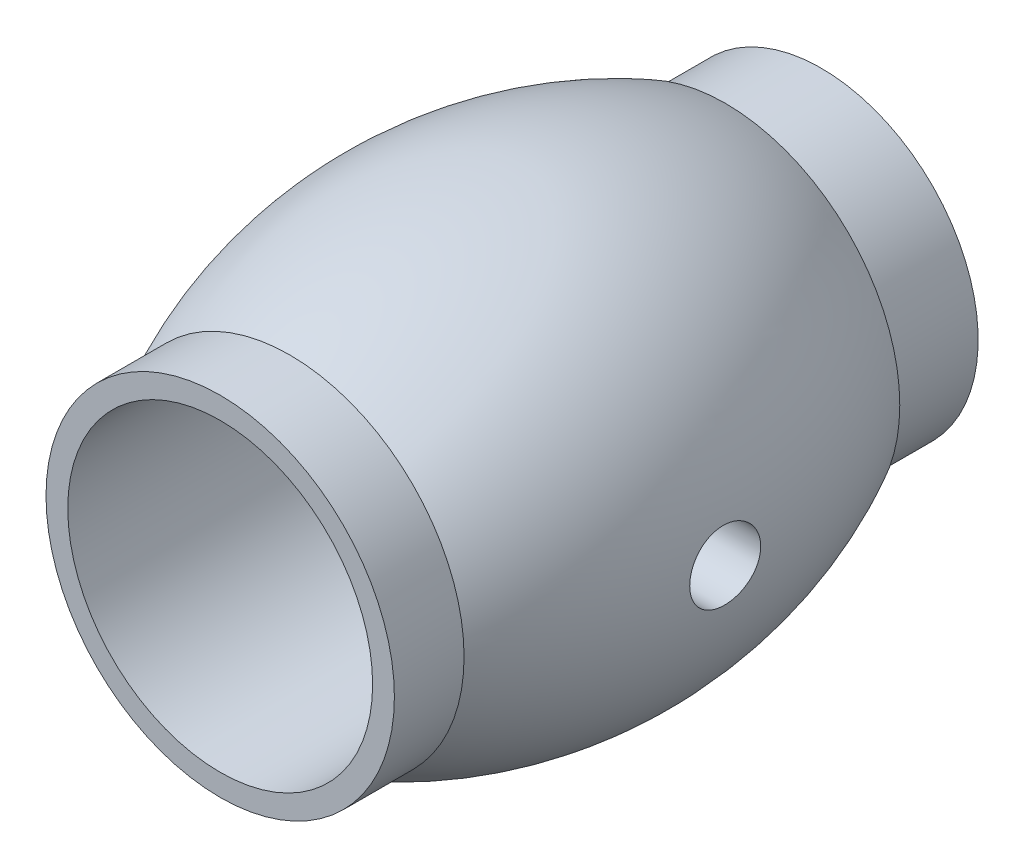
from build123d import *

# Parameters (mm, degrees)
SKETCH1_R           = 25.4
BOSS_EXTRUDE1_DEPTH = 10.16
SKETCH4_R           = 22.225
CUT_EXTRUDE1_DEPTH  = 88.378237328
SKETCH5_R           = 22.86
BOSS_EXTRUDE2_DEPTH = 13.97
SKETCH6_R           = 22.225
CUT_EXTRUDE2_DEPTH  = 100.443725613
SKETCH7_R           = 5.08
CUT_EXTRUDE3_DEPTH  = 127


with BuildPart() as part:
    # Sketch1 → Boss-Extrude1 (new body)
    with BuildSketch(Plane.XY):
        Circle(SKETCH1_R)
    extrude(amount=-BOSS_EXTRUDE1_DEPTH)

    # Sketch3 → Revolve1 (revolve)
    with BuildSketch(Plane(origin=(0, 0, 0), x_dir=(0, 0, -1), z_dir=(1, 0, 0)), mode=Mode.PRIVATE) as revolve1_sk:
        with BuildLine():
            Line((10.16, 25.4), (10.16, 0))
            Line((10.16, 0), (73.691385827, 0))
            Line((73.691385827, 0), (73.691385827, 25.4))
            ThreePointArc((73.691385827, 25.4), (41.925692914, 33.200421573), (10.16, 25.4))
        make_face()
    revolve(revolve1_sk.sketch.rotate(Axis((0, 0, 91.444386702), (0, 0, -1)), 90), axis=Axis((0, 0, 91.444386702), (0, 0, -1)))

    # Sketch4 → Cut-Extrude1 (cut, through all)
    with BuildSketch(Plane.XY):
        Circle(SKETCH4_R)
    extrude(amount=-CUT_EXTRUDE1_DEPTH, mode=Mode.SUBTRACT)

    # Sketch7 → Cut-Extrude3 (cut, symmetric)
    with BuildSketch(Plane(origin=(0, 0, 0), x_dir=(0, 0, -1), z_dir=(1, 0, 0))):
        with Locations((40.64, 0)):
            Circle(SKETCH7_R)
    extrude(amount=CUT_EXTRUDE3_DEPTH, both=True, mode=Mode.SUBTRACT)


with BuildPart() as body_2:
    # Sketch5 → Boss-Extrude2 (new body)
    with BuildSketch(Plane(origin=(0, 0, -73.691385827), x_dir=(-1, 0, 0), z_dir=(0, 0, -1))):
        Circle(SKETCH5_R)
    extrude(amount=BOSS_EXTRUDE2_DEPTH)

    # Sketch6 → Cut-Extrude2 (cut, through all)
    with BuildSketch(Plane(origin=(0, 0, -87.661385827), x_dir=(-1, 0, 0), z_dir=(0, 0, -1))):
        Circle(SKETCH6_R)
    extrude(amount=-CUT_EXTRUDE2_DEPTH, mode=Mode.SUBTRACT)


solid = Compound([part.part, body_2.part])
